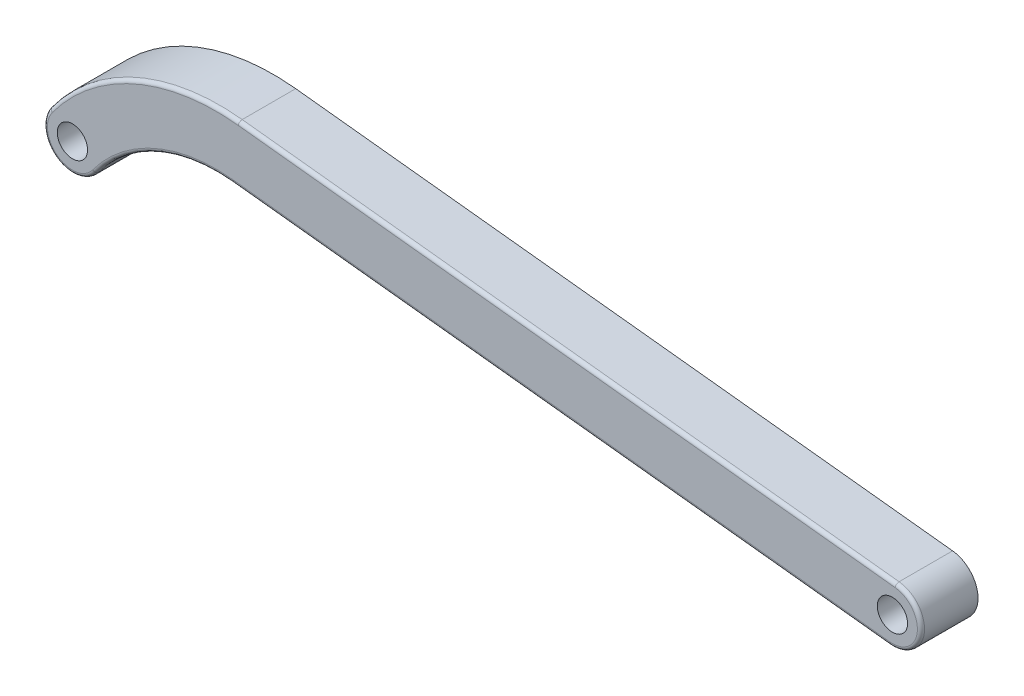
from build123d import *

# Parameters (mm, degrees)
SKETCH2_R           = 2.125
BOSS_EXTRUDE1_DEPTH = 8
FILLET2_R           = 0.5


with BuildPart() as part:
    # Sketch2 → Boss-Extrude1 (new body)
    with BuildSketch(Plane.XY):
        with BuildLine():
            Line((22.446269754, 6.096308238), (114.565217391, -3.976300301))
            ThreePointArc((114.565217391, -3.976300301), (118.976300301, -0.434782609), (115.434782609, 3.976300301))
            Line((115.434782609, 3.976300301), (23.315834971, 14.04890884))
            ThreePointArc((23.315834971, 14.04890884), (8.479435153, 11.762752399), (-3.226185769, 2.364682935))
            ThreePointArc((-3.226185769, 2.364682935), (-2.364682935, -3.226185769), (3.226185769, -2.364682935))
            ThreePointArc((3.226185769, -2.364682935), (11.702669886, 4.440815643), (22.446269754, 6.096308238))
        make_face()
        Circle(SKETCH2_R, mode=Mode.SUBTRACT)
        with Locations((115, 0)):
            Circle(SKETCH2_R, mode=Mode.SUBTRACT)
    extrude(amount=BOSS_EXTRUDE1_DEPTH)

    # Fillet2
    fillet2_edges = [part.edges().sort_by_distance(p)[0] for p in [
        (118.976300301, -0.434782609, 8),
        (69.37530879, 9.01260457, 8),
        (8.479435153, 11.762752399, 8),
        (-2.364682935, -3.226185769, 8),
        (11.702669886, 4.440815643, 8),
        (68.505743573, 1.060003968, 8),
    ]]
    fillet(fillet2_edges, radius=FILLET2_R)


solid = part.part
